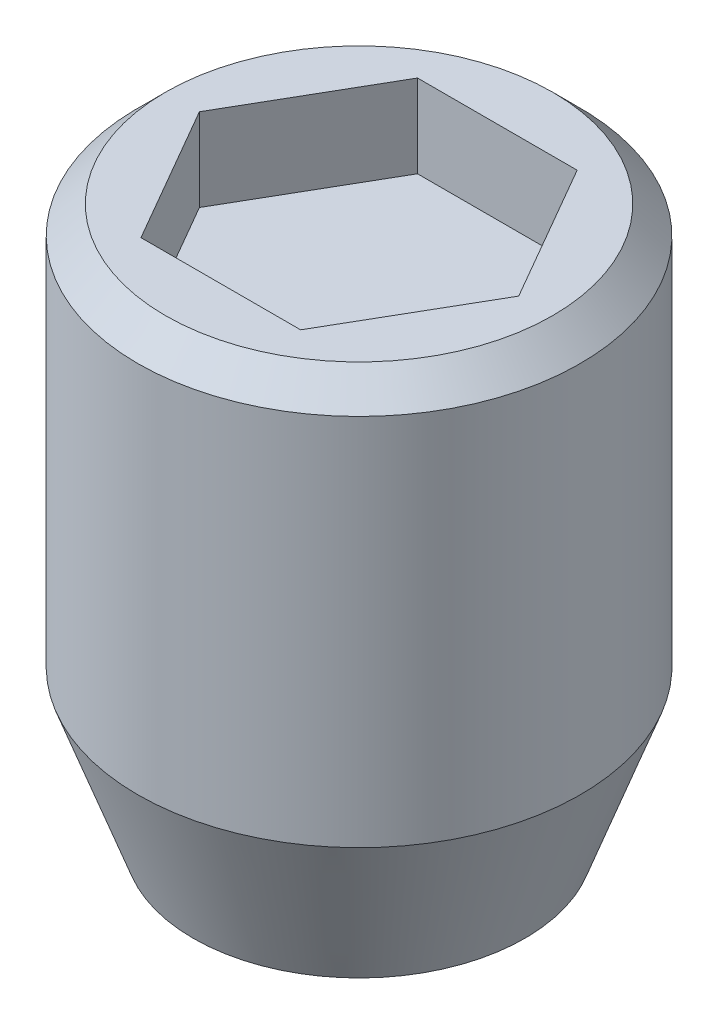
from build123d import *

# Parameters (mm, degrees)
SKETCH2_R           = 4
BOSS_EXTRUDE1_DEPTH = 10
CUT_EXTRUDE1_DEPTH  = 1.5
CHAMFER1_SIZE       = 0.5
CHAMFER2_SIZE       = 1
CHAMFER2_SIZE2      = 2.747477419


with BuildPart() as part:
    # Sketch2 → Boss-Extrude1 (new body)
    with BuildSketch(Plane(origin=(0, 0, 0), x_dir=(1, 0, 0), z_dir=(0, 1, 0))):
        with Locations(Location((0, 0, 0), (0, 0, 270))):
            Circle(SKETCH2_R)
    extrude(amount=BOSS_EXTRUDE1_DEPTH)

    # Sketch3 → Cut-Extrude1 (cut)
    with BuildSketch(Plane(origin=(0, 10, 0), x_dir=(1, 0, 0), z_dir=(0, 1, 0))):
        Polygon((2.886751346, 0), (1.443375673, 2.5), (-1.443375673, 2.5), (-2.886751346, 0), (-1.443375673, -2.5), (1.443375673, -2.5), align=None)
    extrude(amount=-CUT_EXTRUDE1_DEPTH, mode=Mode.SUBTRACT)

    # Chamfer1
    chamfer1_edges = [part.edges().sort_by_distance(p)[0] for p in [
        (0, 10, -4),
    ]]
    chamfer(chamfer1_edges, length=CHAMFER1_SIZE)

    # Chamfer2
    chamfer2_edges = [part.edges().sort_by_distance(p)[0] for p in [
        (0, 0, -4),
    ]]
    chamfer2_side = [part.faces().sort_by_distance(p)[0] for p in [
        (0, 0, 0),
    ]]
    chamfer(chamfer2_edges, length=CHAMFER2_SIZE, length2=CHAMFER2_SIZE2, reference=chamfer2_side[0])


solid = part.part
